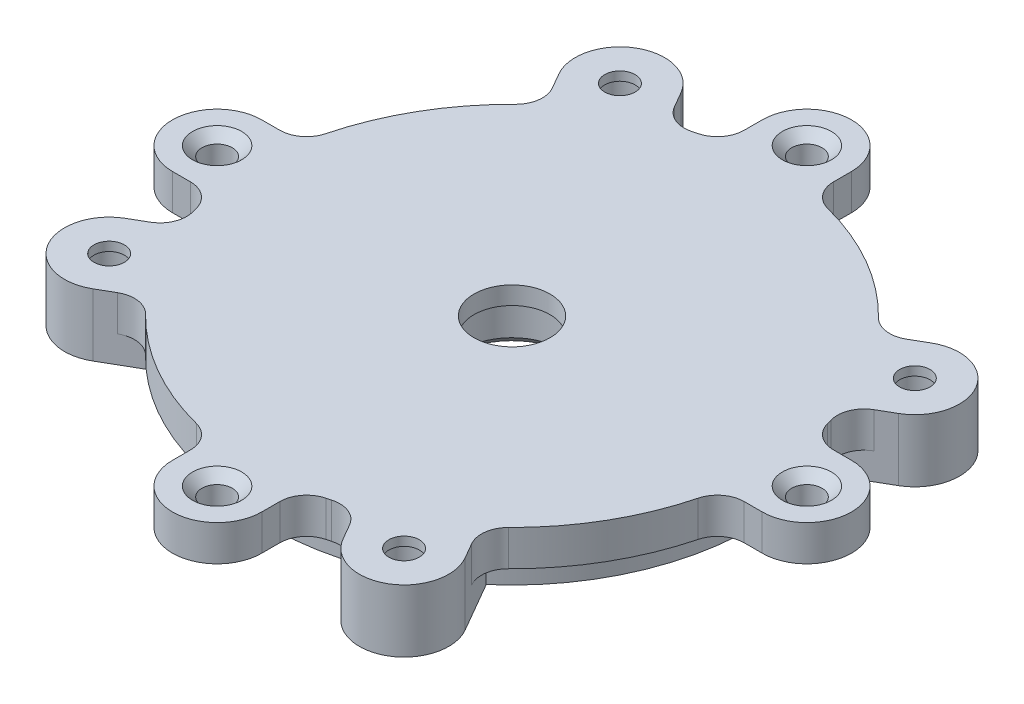
from build123d import *

# Parameters (mm, degrees)
ESQUISSE1_R                        = 1.7
BOSS_EXTRU_1_DEPTH                 = 4
CONG_1_R                           = 3
R_P_TITION_CIRCULAIRE1_COUNT       = 4
CONG_1_OF_R_P_TITION_CIRCULAIRE1_R = 3
CHANFREIN1_SIZE                    = 1.05
BOSS_EXTRU_2_REACH                 = 56.194
ESQUISSE2_R                        = 2.4
CONG_2_R                           = 3
ESQUISSE2_2_R                      = 2.4
BOSS_EXTRU_3_DEPTH                 = 1
M3_CLEARANCE_HOLE1_D               = 3.4
CHANFREIN2_SIZE                    = 0.5


with BuildPart() as part:
    # Sketch1 → Revolve1 (revolve)
    with BuildSketch(Plane.XY, mode=Mode.PRIVATE) as revolve1_sk:
        Polygon((6.5, 0), (27, 0), (27, 3), (29, 3), (29, 7), (4.25, 7), (4.25, 5), (5.5, 5), (5.5, 1), align=None)
    revolve(revolve1_sk.sketch.rotate(Axis((0, 16.318563478, 0), (0, -1, 0)), 90), axis=Axis((0, 16.318563478, 0), (0, -1, 0)))

    # Esquisse1 → Boss.-Extru.1 (add)
    with BuildSketch(Plane(origin=(0, 7, 0), x_dir=(1, 0, 0), z_dir=(0, 1, 0))):
        with BuildLine():
            Line((-5, 33), (-5, 28.565713714))
            ThreePointArc((-5, 28.565713714), (0, 29), (5, 28.565713714))
            Line((5, 28.565713714), (5, 33))
            ThreePointArc((5, 33), (0, 38), (-5, 33))
        make_face()
        with Locations(Location((0, 33, 0), (0, 0, 270))):
            Circle(ESQUISSE1_R, mode=Mode.SUBTRACT)
    boss_extru_1 = extrude(amount=-BOSS_EXTRU_1_DEPTH)

    # Congé1
    cong_1_edges = [part.edges().sort_by_distance(p)[0] for p in [
        (-5, 5, -28.565713714),
        (5, 5, -28.565713714),
    ]]
    fillet(cong_1_edges, radius=CONG_1_R)

    # Répétition circulaire1: Boss.-Extru.1 ×4 about axis
    r_p_tition_circulaire1_axis = Axis((0, 0, 0), (0, 1, 0))
    for i in range(1, R_P_TITION_CIRCULAIRE1_COUNT):
        add(boss_extru_1.rotate(r_p_tition_circulaire1_axis, i * 360 / R_P_TITION_CIRCULAIRE1_COUNT))

    # Congé1 of Répétition circulaire1
    cong_1_of_r_p_tition_circulaire1_edges = [part.edges().sort_by_distance(p)[0] for p in [
        (-28.565713714, 5, 5),
        (-28.565713714, 5, -5),
        (5, 5, 28.565713714),
        (-5, 5, 28.565713714),
        (28.565713714, 5, -5),
        (28.565713714, 5, 5),
    ]]
    fillet(cong_1_of_r_p_tition_circulaire1_edges, radius=CONG_1_OF_R_P_TITION_CIRCULAIRE1_R)

    # Chanfrein1
    chanfrein1_edges = [part.edges().sort_by_distance(p)[0] for p in [
        (0, 7, -34.7),
        (34.7, 7, 0),
        (0, 7, 34.7),
        (-34.7, 7, 0),
    ]]
    chamfer(chanfrein1_edges, length=CHANFREIN1_SIZE)

    # Boss.-Extru.2: up to this face of the body (flat: up to its plane)
    boss_extru_2_end = Plane(part.part.faces().sort_by_distance((0, 0, -7.263675324))[0])
    # Esquisse2 → Boss.-Extru.2 (add, up to the picked face)
    with BuildSketch(Plane(origin=(0, 7, 0), x_dir=(1, 0, 0), z_dir=(0, 1, 0)), mode=Mode.PRIVATE) as boss_extru_2_sk1:
        with BuildLine():
            Line((-12.169872981, 31.078838325), (-8.936372142, 25.478250586))
            ThreePointArc((-8.936372142, 25.478250586), (-13.5, 23.382685902), (-17.59662618, 20.478250586))
            Line((-17.59662618, 20.478250586), (-20.830127019, 26.078838325))
            ThreePointArc((-20.830127019, 26.078838325), (-19, 32.908965344), (-12.169872981, 31.078838325))
        make_face()
        with Locations(Location((-16.5, 28.578838325, 0), (0, 0, 270))):
            Circle(ESQUISSE2_R, mode=Mode.SUBTRACT)
    boss_extru_2_tool1 = split(extrude(boss_extru_2_sk1.sketch, amount=-BOSS_EXTRU_2_REACH, mode=Mode.PRIVATE), bisect_by=boss_extru_2_end, keep=Keep.BOTH, mode=Mode.PRIVATE)
    # Esquisse2 → Boss.-Extru.2 (add, up to the picked face)
    with BuildSketch(Plane(origin=(0, 7, 0), x_dir=(1, 0, 0), z_dir=(0, 1, 0)), mode=Mode.PRIVATE) as boss_extru_2_sk2:
        with BuildLine():
            Line((31.078838325, 12.169872981), (25.478250586, 8.936372142))
            ThreePointArc((25.478250586, 8.936372142), (23.382685902, 13.5), (20.478250586, 17.59662618))
            Line((20.478250586, 17.59662618), (26.078838325, 20.830127019))
            ThreePointArc((26.078838325, 20.830127019), (32.908965344, 19), (31.078838325, 12.169872981))
        make_face()
        with Locations(Location((28.578838325, 16.5, 0), (0, 0, 270))):
            Circle(ESQUISSE2_R, mode=Mode.SUBTRACT)
    boss_extru_2_tool2 = split(extrude(boss_extru_2_sk2.sketch, amount=-BOSS_EXTRU_2_REACH, mode=Mode.PRIVATE), bisect_by=boss_extru_2_end, keep=Keep.BOTH, mode=Mode.PRIVATE)
    # Esquisse2 → Boss.-Extru.2 (add, up to the picked face)
    with BuildSketch(Plane(origin=(0, 7, 0), x_dir=(1, 0, 0), z_dir=(0, 1, 0)), mode=Mode.PRIVATE) as boss_extru_2_sk3:
        with BuildLine():
            Line((20.830127019, -26.078838325), (17.59662618, -20.478250586))
            ThreePointArc((17.59662618, -20.478250586), (13.5, -23.382685902), (8.936372142, -25.478250586))
            Line((8.936372142, -25.478250586), (12.169872981, -31.078838325))
            ThreePointArc((12.169872981, -31.078838325), (19, -32.908965344), (20.830127019, -26.078838325))
        make_face()
        with Locations(Location((16.5, -28.578838325, 0), (0, 0, 270))):
            Circle(ESQUISSE2_R, mode=Mode.SUBTRACT)
    boss_extru_2_tool3 = split(extrude(boss_extru_2_sk3.sketch, amount=-BOSS_EXTRU_2_REACH, mode=Mode.PRIVATE), bisect_by=boss_extru_2_end, keep=Keep.BOTH, mode=Mode.PRIVATE)
    # Esquisse2 → Boss.-Extru.2 (add, up to the picked face)
    with BuildSketch(Plane(origin=(0, 7, 0), x_dir=(1, 0, 0), z_dir=(0, 1, 0)), mode=Mode.PRIVATE) as boss_extru_2_sk4:
        with BuildLine():
            Line((-26.078838325, -20.830127019), (-20.478250586, -17.59662618))
            ThreePointArc((-20.478250586, -17.59662618), (-23.382685902, -13.5), (-25.478250586, -8.936372142))
            Line((-25.478250586, -8.936372142), (-31.078838325, -12.169872981))
            ThreePointArc((-31.078838325, -12.169872981), (-32.908965344, -19), (-26.078838325, -20.830127019))
        make_face()
        with Locations(Location((-28.578838325, -16.5, 0), (0, 0, 270))):
            Circle(ESQUISSE2_R, mode=Mode.SUBTRACT)
    boss_extru_2_tool4 = split(extrude(boss_extru_2_sk4.sketch, amount=-BOSS_EXTRU_2_REACH, mode=Mode.PRIVATE), bisect_by=boss_extru_2_end, keep=Keep.BOTH, mode=Mode.PRIVATE)
    add(boss_extru_2_tool1.solids().sort_by(Axis((-19.056182, 7, -23.369301), (0, -1, 0)))[0])
    add(boss_extru_2_tool2.solids().sort_by(Axis((32.75177, 7, -18.909243), (0, -1, 0)))[0])
    add(boss_extru_2_tool3.solids().sort_by(Axis((10.710318, 7, 28.187788), (0, -1, 0)))[0])
    add(boss_extru_2_tool4.solids().sort_by(Axis((-23.539881, 7, 13.590757), (0, -1, 0)))[0])

    # Congé2
    cong_2_edges = [part.edges().sort_by_distance(p)[0] for p in [
        (-22.238633754, 5, 18.612983876),
        (-27.238633754, 5, 9.952729838),
        (-18.612983876, 5, -22.238633754),
        (-9.952729838, 5, -27.238633754),
        (22.238633754, 5, -18.612983876),
        (27.238633754, 5, -9.952729838),
        (18.612983876, 5, 22.238633754),
        (9.952729838, 5, 27.238633754),
    ]]
    fillet(cong_2_edges, radius=CONG_2_R)

    # Esquisse2<2> → Boss.-Extru.3 (add)
    with BuildSketch(Plane(origin=(0, 7, 0), x_dir=(1, 0, 0), z_dir=(0, 1, 0))):
        with Locations(Location((16.5, -28.578838325, 0), (0, 0, 270))):
            Circle(ESQUISSE2_2_R)
        with Locations(Location((28.578838325, 16.5, 0), (0, 0, 270))):
            Circle(ESQUISSE2_2_R)
        with Locations(Location((-16.5, 28.578838325, 0), (0, 0, 270))):
            Circle(ESQUISSE2_2_R)
        with Locations(Location((-28.578838325, -16.5, 0), (0, 0, 270))):
            Circle(ESQUISSE2_2_R)
    extrude(amount=-BOSS_EXTRU_3_DEPTH)

    # M3 Clearance Hole1 (through all)
    with Locations(Plane(origin=(0, 7, 0), x_dir=(1, 0, 0), z_dir=(0, 1, 0))):
        with Locations((16.5, -28.578838325), (28.578838325, 16.5), (-16.5, 28.578838325), (-28.578838325, -16.5)):
            Hole(M3_CLEARANCE_HOLE1_D / 2)

    # Chanfrein2
    chanfrein2_edges = [part.edges().sort_by_distance(p)[0] for p in [
        (-28.578838325, 0, 14.1),
        (-16.5, 0, -30.978838325),
        (28.578838325, 0, -18.9),
        (16.5, 0, 26.178838325),
    ]]
    chamfer(chanfrein2_edges, length=CHANFREIN2_SIZE)


solid = part.part
